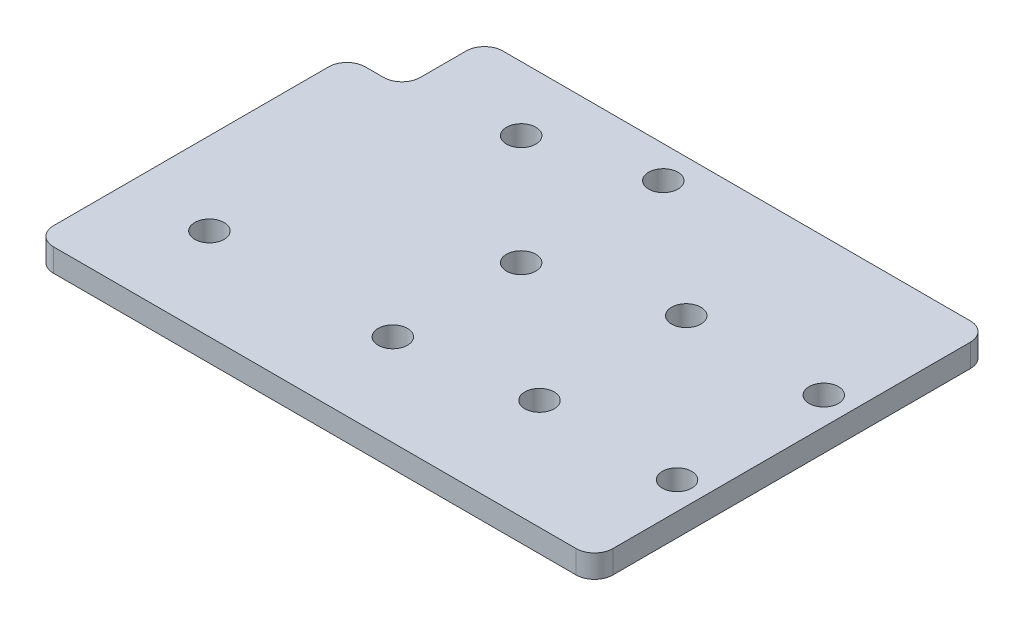
from build123d import *

# Parameters (mm, degrees)
SKETCH_1_R      = 1.6
EXTRUDE_1_DEPTH = 2.5
FILLET_1_R      = 2


with BuildPart() as part:
    # 草图1 → 凸台-拉伸1 (new body)
    with BuildSketch(Plane(origin=(0, 0, 0), x_dir=(-1, 0, 0), z_dir=(0, 1, 0))):
        Polygon((-27.5, 21.5), (27.5, 21.5), (33.5, 21.5), (33.5, -12.5), (27.5, -12.5), (27.5, -21.5), (-27.5, -21.5), align=None)
        with Locations(Location((-24.5, 9.5, 0), (0, 0, 90))):
            Circle(SKETCH_1_R, mode=Mode.SUBTRACT)
        with Locations(Location((-9.5, 9.5, 0), (0, 0, 90))):
            Circle(SKETCH_1_R, mode=Mode.SUBTRACT)
        with Locations(Location((-24.5, -6.5, 0), (0, 0, 90))):
            Circle(SKETCH_1_R, mode=Mode.SUBTRACT)
        with Locations(Location((-9.5, -6.5, 0), (0, 0, 90))):
            Circle(SKETCH_1_R, mode=Mode.SUBTRACT)
        with Locations(Location((4.5, -2.5, 0), (0, 0, 90))):
            Circle(SKETCH_1_R, mode=Mode.SUBTRACT)
        with Locations(Location((4.5, 11.5, 0), (0, 0, 90))):
            Circle(SKETCH_1_R, mode=Mode.SUBTRACT)
        with Locations(Location((24.5, 11.5, 0), (0, 0, 90))):
            Circle(SKETCH_1_R, mode=Mode.SUBTRACT)
        with Locations(Location((16.5, -14.5, 0), (0, 0, 90))):
            Circle(SKETCH_1_R, mode=Mode.SUBTRACT)
        with Locations(Location((4.5, -18, 0), (0, 0, 90))):
            Circle(SKETCH_1_R, mode=Mode.SUBTRACT)
    extrude(amount=EXTRUDE_1_DEPTH)

    # 圆角1
    fillet_1_edges = [part.edges().sort_by_distance(p)[0] for p in [
        (27.5, 1.25, 21.5),
        (-33.5, 1.25, 21.5),
        (-33.5, 1.25, -12.5),
        (-27.5, 1.25, -12.5),
        (-27.5, 1.25, -21.5),
        (27.5, 1.25, -21.5),
    ]]
    fillet(fillet_1_edges, radius=FILLET_1_R)


solid = part.part
